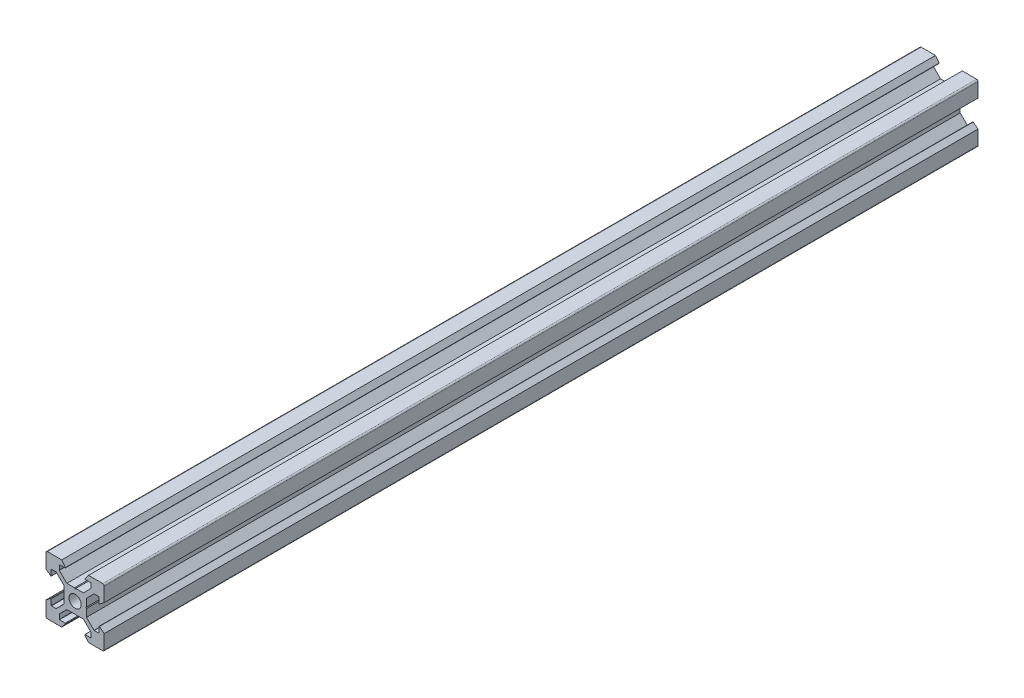
from build123d import *

# Parameters (mm, degrees)
SKETCH1_R           = 2.1
BOSS_EXTRUDE1_DEPTH = 300
FILLET1_R           = 0.5


with BuildPart() as part:
    # Sketch1 → Boss-Extrude1 (new body)
    with BuildSketch(Plane.XY):
        with BuildLine():
            Line((-3.325528714, 8.361394061), (-4.6, 10))
            Line((-4.6, 10), (-10, 10))
            Line((-10, 10), (-10, 4.6))
            Line((-10, 4.6), (-8.361394061, 3.325528714))
            ThreePointArc((-8.361394061, 3.325528714), (-8.256064855, 3.31463241), (-8.2, 3.404463936))
            Line((-8.2, 3.404463936), (-8.2, 5.347413399))
            ThreePointArc((-8.2, 5.347413399), (-8.170710678, 5.418124078), (-8.1, 5.447413399))
            Line((-8.1, 5.447413399), (-6.549494927, 5.447413399))
            ThreePointArc((-6.549494927, 5.447413399), (-6.511226584, 5.439801353), (-6.478784249, 5.418124078))
            Line((-6.478784249, 5.418124078), (-3.9, 2.839339828))
            Line((-3.9, 2.839339828), (-3.9, 0.212132034))
            Line((-3.9, 0.212132034), (-3.687867966, 0))
            Line((-3.687867966, 0), (-3.9, -0.212132034))
            Line((-3.9, -0.212132034), (-3.9, -2.839339828))
            Line((-3.9, -2.839339828), (-6.478784249, -5.418124078))
            ThreePointArc((-6.478784249, -5.418124078), (-6.511226584, -5.439801353), (-6.549494927, -5.447413399))
            Line((-6.549494927, -5.447413399), (-8.1, -5.447413399))
            ThreePointArc((-8.1, -5.447413399), (-8.170710678, -5.418124078), (-8.2, -5.347413399))
            Line((-8.2, -5.347413399), (-8.2, -3.404463936))
            ThreePointArc((-8.2, -3.404463936), (-8.256064855, -3.31463241), (-8.361394061, -3.325528714))
            Line((-8.361394061, -3.325528714), (-10, -4.6))
            Line((-10, -4.6), (-10, -10))
            Line((-10, -10), (-4.6, -10))
            Line((-4.6, -10), (-3.325528714, -8.361394061))
            ThreePointArc((-3.325528714, -8.361394061), (-3.31463241, -8.256064855), (-3.404463936, -8.2))
            Line((-3.404463936, -8.2), (-5.347413399, -8.2))
            ThreePointArc((-5.347413399, -8.2), (-5.418124078, -8.170710678), (-5.447413399, -8.1))
            Line((-5.447413399, -8.1), (-5.447413399, -6.549494927))
            ThreePointArc((-5.447413399, -6.549494927), (-5.439801353, -6.511226584), (-5.418124078, -6.478784249))
            Line((-5.418124078, -6.478784249), (-2.839339828, -3.9))
            Line((-2.839339828, -3.9), (-0.212132034, -3.9))
            Line((-0.212132034, -3.9), (0, -3.687867966))
            Line((0, -3.687867966), (0.212132034, -3.9))
            Line((0.212132034, -3.9), (2.839339828, -3.9))
            Line((2.839339828, -3.9), (5.418124078, -6.478784249))
            ThreePointArc((5.418124078, -6.478784249), (5.439801353, -6.511226584), (5.447413399, -6.549494927))
            Line((5.447413399, -6.549494927), (5.447413399, -8.1))
            ThreePointArc((5.447413399, -8.1), (5.418124078, -8.170710678), (5.347413399, -8.2))
            Line((5.347413399, -8.2), (3.404463936, -8.2))
            ThreePointArc((3.404463936, -8.2), (3.31463241, -8.256064855), (3.325528714, -8.361394061))
            Line((3.325528714, -8.361394061), (4.6, -10))
            Line((4.6, -10), (10, -10))
            Line((10, -10), (10, -4.6))
            Line((10, -4.6), (8.361394061, -3.325528714))
            ThreePointArc((8.361394061, -3.325528714), (8.256064855, -3.31463241), (8.2, -3.404463936))
            Line((8.2, -3.404463936), (8.2, -5.347413399))
            ThreePointArc((8.2, -5.347413399), (8.170710678, -5.418124078), (8.1, -5.447413399))
            Line((8.1, -5.447413399), (6.549494927, -5.447413399))
            ThreePointArc((6.549494927, -5.447413399), (6.511226584, -5.439801353), (6.478784249, -5.418124078))
            Line((6.478784249, -5.418124078), (3.9, -2.839339828))
            Line((3.9, -2.839339828), (3.9, -0.212132034))
            Line((3.9, -0.212132034), (3.687867966, 0))
            Line((3.687867966, 0), (3.9, 0.212132034))
            Line((3.9, 0.212132034), (3.9, 2.839339828))
            Line((3.9, 2.839339828), (6.478784249, 5.418124078))
            ThreePointArc((6.478784249, 5.418124078), (6.511226584, 5.439801353), (6.549494927, 5.447413399))
            Line((6.549494927, 5.447413399), (8.1, 5.447413399))
            ThreePointArc((8.1, 5.447413399), (8.170710678, 5.418124078), (8.2, 5.347413399))
            Line((8.2, 5.347413399), (8.2, 3.404463936))
            ThreePointArc((8.2, 3.404463936), (8.256064855, 3.31463241), (8.361394061, 3.325528714))
            Line((8.361394061, 3.325528714), (10, 4.6))
            Line((10, 4.6), (10, 10))
            Line((10, 10), (4.6, 10))
            Line((4.6, 10), (3.325528714, 8.361394061))
            ThreePointArc((3.325528714, 8.361394061), (3.31463241, 8.256064855), (3.404463936, 8.2))
            Line((3.404463936, 8.2), (5.347413399, 8.2))
            ThreePointArc((5.347413399, 8.2), (5.418124078, 8.170710678), (5.447413399, 8.1))
            Line((5.447413399, 8.1), (5.447413399, 6.549494927))
            ThreePointArc((5.447413399, 6.549494927), (5.439801353, 6.511226584), (5.418124078, 6.478784249))
            Line((5.418124078, 6.478784249), (2.839339828, 3.9))
            Line((2.839339828, 3.9), (0.212132034, 3.9))
            Line((0.212132034, 3.9), (0, 3.687867966))
            Line((0, 3.687867966), (-0.212132034, 3.9))
            Line((-0.212132034, 3.9), (-2.839339828, 3.9))
            Line((-2.839339828, 3.9), (-5.418124078, 6.478784249))
            ThreePointArc((-5.418124078, 6.478784249), (-5.439801353, 6.511226584), (-5.447413399, 6.549494927))
            Line((-5.447413399, 6.549494927), (-5.447413399, 8.1))
            ThreePointArc((-5.447413399, 8.1), (-5.418124078, 8.170710678), (-5.347413399, 8.2))
            Line((-5.347413399, 8.2), (-3.404463936, 8.2))
            ThreePointArc((-3.404463936, 8.2), (-3.31463241, 8.256064855), (-3.325528714, 8.361394061))
        make_face()
        Circle(SKETCH1_R, mode=Mode.SUBTRACT)
    extrude(amount=-BOSS_EXTRUDE1_DEPTH)

    # Fillet1
    fillet1_edges = [part.edges().sort_by_distance(p)[0] for p in [
        (-10, -10, -150),
        (-10, 10, -150),
        (10, 10, -150),
        (10, -10, -150),
    ]]
    fillet(fillet1_edges, radius=FILLET1_R)


solid = part.part
